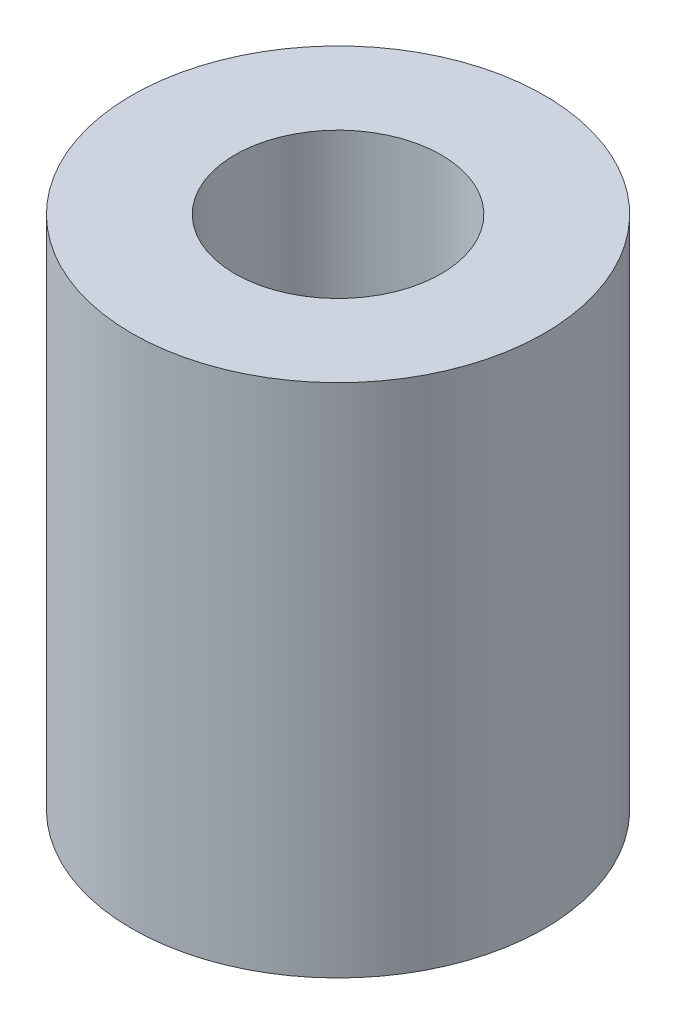
from build123d import *

# Parameters (mm, degrees)
SKETCH_1_R          = 16
EXTRUDE_1_DEPTH     = 40
SKETCH_2_R          = 8
CUT_EXTRUDE_1_DEPTH = 20
SKETCH_3_R          = 4
CUT_EXTRUDE_2_DEPTH = 20


with BuildPart() as part:
    # 草图1 → 凸台-拉伸1 (new body)
    with BuildSketch(Plane(origin=(0, 0, 0), x_dir=(1, 0, 0), z_dir=(0, 1, 0))):
        with Locations(Location((0, 0, 0), (0, 0, 270))):
            Circle(SKETCH_1_R)
    extrude(amount=EXTRUDE_1_DEPTH)

    # 草图2 → 切除-拉伸1 (cut)
    with BuildSketch(Plane(origin=(0, 40, 0), x_dir=(1, 0, 0), z_dir=(0, 1, 0))):
        with Locations(Location((0, 0, 0), (0, 0, 270))):
            Circle(SKETCH_2_R)
    extrude(amount=-CUT_EXTRUDE_1_DEPTH, mode=Mode.SUBTRACT)

    # 草图3 → 切除-拉伸2 (cut)
    with BuildSketch(Plane.XZ):
        with Locations(Location((0, 0, 0), (0, 0, 270))):
            Circle(SKETCH_3_R)
    extrude(amount=-CUT_EXTRUDE_2_DEPTH, mode=Mode.SUBTRACT)


solid = part.part
